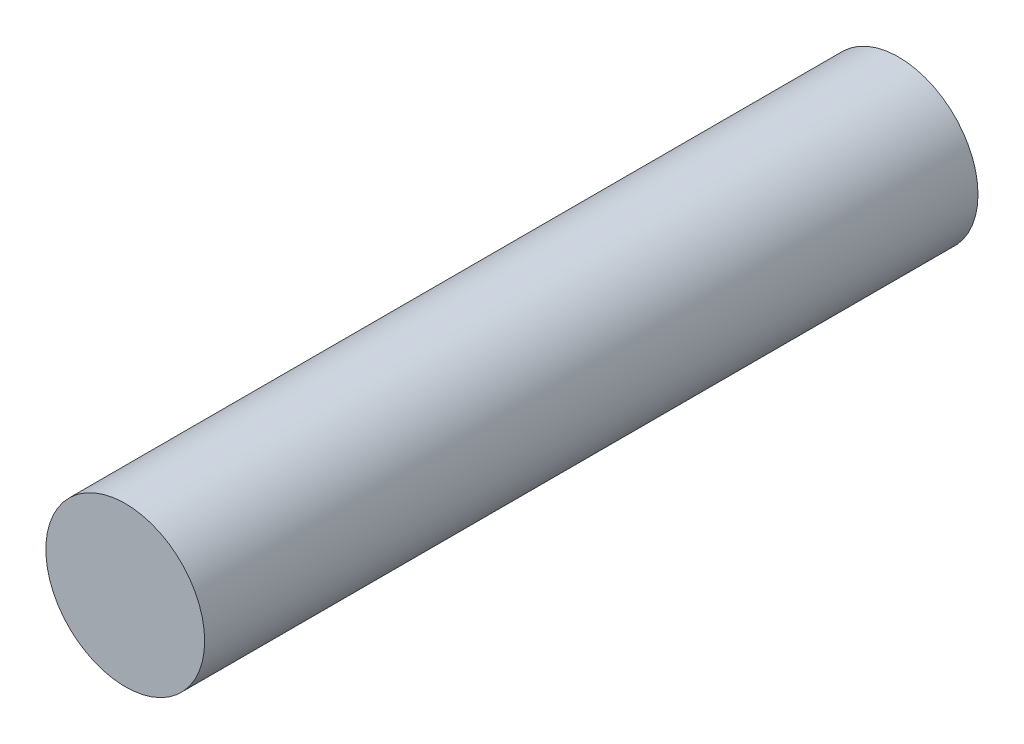
from build123d import *

# Parameters (mm, degrees)
ESQUISSE1_R        = 5.75
BOSS_EXTRU_1_DEPTH = 56


with BuildPart() as part:
    # Esquisse1 → Boss.-Extru.1 (new body)
    with BuildSketch(Plane.XY):
        Circle(ESQUISSE1_R)
    extrude(amount=BOSS_EXTRU_1_DEPTH)


solid = part.part
